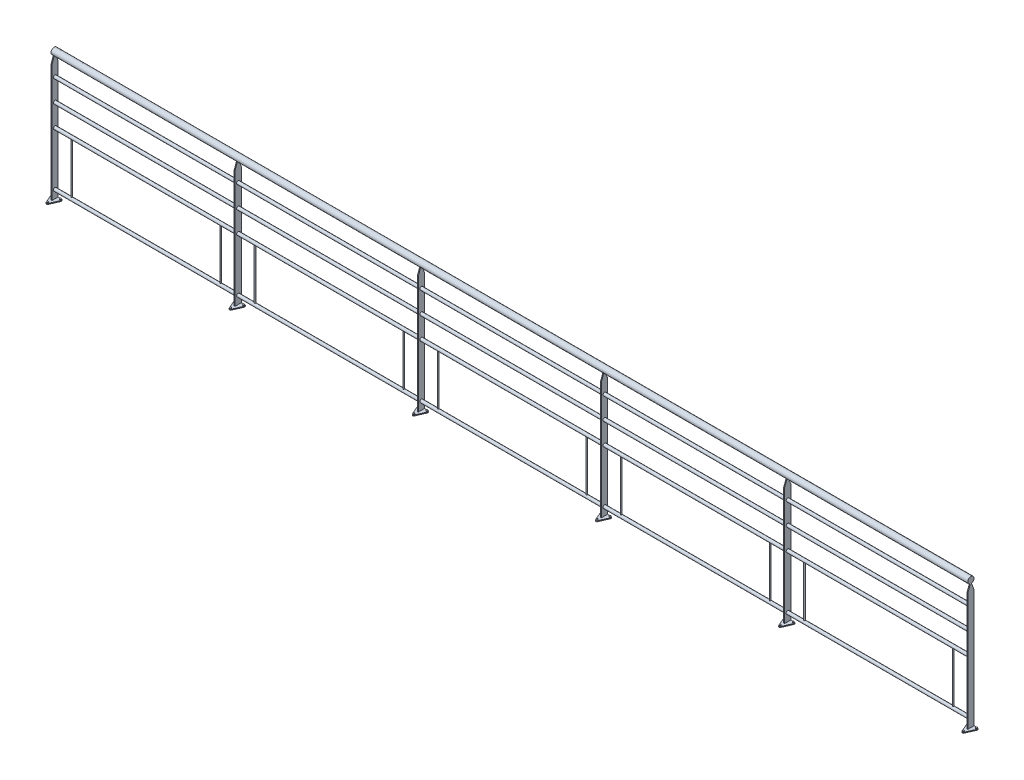
from build123d import *

# Parameters (mm, degrees)
BOSS_EXTRU_1_DEPTH                  = 7285
ESQUISSE3_W                         = 1448.6
ESQUISSE3_H                         = 990.505102572
ENL_V_MAT_EXTRU_1_DEPTH             = 7304.902739623
ESQUISSE4_R                         = 25
ESQUISSE4_R_2                       = 12.5
BOSS_EXTRU_2_DEPTH                  = 7285
BOSS_EXTRU_3_REACH                  = 7309.484
BOSS_EXTRU_3_END_RADIUS             = 12.5
ESQUISSE5_R                         = 4.5
BOSS_EXTRU_3_DIRECTION_2_REACH      = 7309.484
BOSS_EXTRU_3_DIRECTION_2_END_RADIUS = 12.5
BOSS_EXTRU_4_DEPTH                  = 7
ESQUISSE7_R                         = 5.5
BOSS_EXTRU_5_DEPTH                  = 10
CONG_1_R                            = 5.5


with BuildPart() as part:
    # Esquisse2 → Boss.-Extru.1 (new body)
    with BuildSketch(Plane(origin=(0, 0, 0), x_dir=(0, 0, -1), z_dir=(1, 0, 0))):
        with BuildLine():
            Line((-25, 467.752551286), (-25, -467.752551286))
            Line((-25, -467.752551286), (25, -467.752551286))
            Line((25, -467.752551286), (25, 467.752551286))
            Line((25, 467.752551286), (5, 522.752551286))
            ThreePointArc((5, 522.752551286), (0, 522.247448714), (-5, 522.752551286))
            Line((-5, 522.752551286), (-25, 467.752551286))
        make_face()
    extrude(amount=-BOSS_EXTRU_1_DEPTH)

    # Esquisse3 → Enlèv. mat.-Extru.1 (cut, through all)
    with BuildSketch(Plane.XY.offset(25)):
        with Locations((-6553.7, 27.5)):
            Rectangle(ESQUISSE3_W, ESQUISSE3_H)
        with Locations((-731.3, 27.5)):
            Rectangle(ESQUISSE3_W, ESQUISSE3_H)
        with Locations((-2186.9, 27.5)):
            Rectangle(ESQUISSE3_W, ESQUISSE3_H)
        with Locations((-3642.5, 27.5)):
            Rectangle(ESQUISSE3_W, ESQUISSE3_H)
        with Locations((-5098.1, 27.5)):
            Rectangle(ESQUISSE3_W, ESQUISSE3_H)
    extrude(amount=-ENL_V_MAT_EXTRU_1_DEPTH, mode=Mode.SUBTRACT)


with BuildPart() as enl_v_mat_extru_1_piece_1:
    # of the separate pieces the step leaves, piece 1, a body of its own (enl_v_mat_extru_1_pieces)
    add(part.part.solids().sort_by_distance((-4366.8, 522.752551286, 5))[0])



with BuildPart() as enl_v_mat_extru_1_piece_2:
    # of the separate pieces the step leaves, piece 2, a body of its own (enl_v_mat_extru_1_pieces)
    add(part.part.solids().sort_by_distance((-2911.2, 522.752551286, 5))[0])


with BuildPart() as enl_v_mat_extru_1_piece_3:
    # of the separate pieces the step leaves, piece 3, a body of its own (enl_v_mat_extru_1_pieces)
    add(part.part.solids().sort_by_distance((-5822.4, 522.752551286, 5))[0])


with BuildPart() as enl_v_mat_extru_1_piece_4:
    # of the separate pieces the step leaves, piece 4, a body of its own (enl_v_mat_extru_1_pieces)
    add(part.part.solids().sort_by_distance((-1455.6, 522.752551286, 5))[0])


with BuildPart() as enl_v_mat_extru_1_piece_5:
    # of the separate pieces the step leaves, piece 5, a body of its own (enl_v_mat_extru_1_pieces)
    add(part.part.solids().sort_by_distance((0, 522.752551286, 5))[0])


with BuildPart() as enl_v_mat_extru_1_piece_6:
    # of the separate pieces the step leaves, piece 6, a body of its own (enl_v_mat_extru_1_pieces)
    add(part.part.solids().sort_by_distance((-7278, 467.752551286, 25))[0])


with BuildPart() as enl_v_mat_extru_1_piece_1_1:
    add(enl_v_mat_extru_1_piece_1.part)

    add(enl_v_mat_extru_1_piece_2.part)  # Boss.-Extru.2 merges Enlèv. mat.-Extru.1 piece 2

    add(enl_v_mat_extru_1_piece_3.part)  # Boss.-Extru.2 merges Enlèv. mat.-Extru.1 piece 3

    add(enl_v_mat_extru_1_piece_4.part)  # Boss.-Extru.2 merges Enlèv. mat.-Extru.1 piece 4

    add(enl_v_mat_extru_1_piece_5.part)  # Boss.-Extru.2 merges Enlèv. mat.-Extru.1 piece 5

    add(enl_v_mat_extru_1_piece_6.part)  # Boss.-Extru.2 merges Enlèv. mat.-Extru.1 piece 6
    # Esquisse4 → Boss.-Extru.2 (add, through all)
    with BuildSketch(Plane(origin=(0, 0, 0), x_dir=(0, 0, -1), z_dir=(1, 0, 0))):
        with Locations(Location((0, 547.247448714, 0), (0, 0, 281.536959033))):
            Circle(ESQUISSE4_R)
        with Locations((0, -402.752551286)):
            Circle(ESQUISSE4_R_2)
        with Locations((0, 22.247448714)):
            Circle(ESQUISSE4_R_2)
        with Locations((0, 197.247448714)):
            Circle(ESQUISSE4_R_2)
        with Locations((0, 372.247448714)):
            Circle(ESQUISSE4_R_2)
    extrude(amount=-BOSS_EXTRU_2_DEPTH)

    # Boss.-Extru.3: up to this cylinder (the profile starts outside it)
    boss_extru_3_end = Plane(origin=(-3642.5, -402.752551286, 0), z_dir=(1, 0, 0)) * Cylinder(BOSS_EXTRU_3_END_RADIUS, 21649.368, mode=Mode.PRIVATE)
    # Esquisse5 → Boss.-Extru.3 (add, up to the surface)
    with BuildSketch(Plane(origin=(0, 0, 0), x_dir=(1, 0, 0), z_dir=(0, 1, 0)), mode=Mode.PRIVATE) as boss_extru_3_sk1:
        with Locations(Location((-7144.7, 0, 0), (0, 0, 90))):
            Circle(ESQUISSE5_R)
    boss_extru_3_tool1 = extrude(boss_extru_3_sk1.sketch, amount=-BOSS_EXTRU_3_REACH, mode=Mode.PRIVATE) - boss_extru_3_end
    add(boss_extru_3_tool1.solids().sort_by_distance((-7144.7, 0, 0))[0])
    # Esquisse5 → Boss.-Extru.3 (add, up to the surface)
    with BuildSketch(Plane(origin=(0, 0, 0), x_dir=(1, 0, 0), z_dir=(0, 1, 0)), mode=Mode.PRIVATE) as boss_extru_3_sk2:
        with Locations(Location((-5962.7, 0, 0), (0, 0, 90))):
            Circle(ESQUISSE5_R)
    boss_extru_3_tool2 = extrude(boss_extru_3_sk2.sketch, amount=-BOSS_EXTRU_3_REACH, mode=Mode.PRIVATE) - boss_extru_3_end
    add(boss_extru_3_tool2.solids().sort_by_distance((-5962.7, 0, 0))[0])
    # Esquisse5 → Boss.-Extru.3 (add, up to the surface)
    with BuildSketch(Plane(origin=(0, 0, 0), x_dir=(1, 0, 0), z_dir=(0, 1, 0)), mode=Mode.PRIVATE) as boss_extru_3_sk3:
        with Locations(Location((-5689.1, 0, 0), (0, 0, 90))):
            Circle(ESQUISSE5_R)
    boss_extru_3_tool3 = extrude(boss_extru_3_sk3.sketch, amount=-BOSS_EXTRU_3_REACH, mode=Mode.PRIVATE) - boss_extru_3_end
    add(boss_extru_3_tool3.solids().sort_by_distance((-5689.1, 0, 0))[0])
    # Esquisse5 → Boss.-Extru.3 (add, up to the surface)
    with BuildSketch(Plane(origin=(0, 0, 0), x_dir=(1, 0, 0), z_dir=(0, 1, 0)), mode=Mode.PRIVATE) as boss_extru_3_sk4:
        with Locations(Location((-4507.1, 0, 0), (0, 0, 90))):
            Circle(ESQUISSE5_R)
    boss_extru_3_tool4 = extrude(boss_extru_3_sk4.sketch, amount=-BOSS_EXTRU_3_REACH, mode=Mode.PRIVATE) - boss_extru_3_end
    add(boss_extru_3_tool4.solids().sort_by_distance((-4507.1, 0, 0))[0])
    # Esquisse5 → Boss.-Extru.3 (add, up to the surface)
    with BuildSketch(Plane(origin=(0, 0, 0), x_dir=(1, 0, 0), z_dir=(0, 1, 0)), mode=Mode.PRIVATE) as boss_extru_3_sk5:
        with Locations(Location((-4233.5, 0, 0), (0, 0, 90))):
            Circle(ESQUISSE5_R)
    boss_extru_3_tool5 = extrude(boss_extru_3_sk5.sketch, amount=-BOSS_EXTRU_3_REACH, mode=Mode.PRIVATE) - boss_extru_3_end
    add(boss_extru_3_tool5.solids().sort_by_distance((-4233.5, 0, 0))[0])
    # Esquisse5 → Boss.-Extru.3 (add, up to the surface)
    with BuildSketch(Plane(origin=(0, 0, 0), x_dir=(1, 0, 0), z_dir=(0, 1, 0)), mode=Mode.PRIVATE) as boss_extru_3_sk6:
        with Locations(Location((-3051.5, 0, 0), (0, 0, 90))):
            Circle(ESQUISSE5_R)
    boss_extru_3_tool6 = extrude(boss_extru_3_sk6.sketch, amount=-BOSS_EXTRU_3_REACH, mode=Mode.PRIVATE) - boss_extru_3_end
    add(boss_extru_3_tool6.solids().sort_by_distance((-3051.5, 0, 0))[0])
    # Esquisse5 → Boss.-Extru.3 (add, up to the surface)
    with BuildSketch(Plane(origin=(0, 0, 0), x_dir=(1, 0, 0), z_dir=(0, 1, 0)), mode=Mode.PRIVATE) as boss_extru_3_sk7:
        with Locations(Location((-2777.9, 0, 0), (0, 0, 90))):
            Circle(ESQUISSE5_R)
    boss_extru_3_tool7 = extrude(boss_extru_3_sk7.sketch, amount=-BOSS_EXTRU_3_REACH, mode=Mode.PRIVATE) - boss_extru_3_end
    add(boss_extru_3_tool7.solids().sort_by_distance((-2777.9, 0, 0))[0])
    # Esquisse5 → Boss.-Extru.3 (add, up to the surface)
    with BuildSketch(Plane(origin=(0, 0, 0), x_dir=(1, 0, 0), z_dir=(0, 1, 0)), mode=Mode.PRIVATE) as boss_extru_3_sk8:
        with Locations(Location((-1595.9, 0, 0), (0, 0, 90))):
            Circle(ESQUISSE5_R)
    boss_extru_3_tool8 = extrude(boss_extru_3_sk8.sketch, amount=-BOSS_EXTRU_3_REACH, mode=Mode.PRIVATE) - boss_extru_3_end
    add(boss_extru_3_tool8.solids().sort_by_distance((-1595.9, 0, 0))[0])
    # Esquisse5 → Boss.-Extru.3 (add, up to the surface)
    with BuildSketch(Plane(origin=(0, 0, 0), x_dir=(1, 0, 0), z_dir=(0, 1, 0)), mode=Mode.PRIVATE) as boss_extru_3_sk9:
        with Locations(Location((-1322.3, 0, 0), (0, 0, 90))):
            Circle(ESQUISSE5_R)
    boss_extru_3_tool9 = extrude(boss_extru_3_sk9.sketch, amount=-BOSS_EXTRU_3_REACH, mode=Mode.PRIVATE) - boss_extru_3_end
    add(boss_extru_3_tool9.solids().sort_by_distance((-1322.3, 0, 0))[0])
    # Esquisse5 → Boss.-Extru.3 (add, up to the surface)
    with BuildSketch(Plane(origin=(0, 0, 0), x_dir=(1, 0, 0), z_dir=(0, 1, 0)), mode=Mode.PRIVATE) as boss_extru_3_sk10:
        with Locations(Location((-140.3, 0, 0), (0, 0, 90))):
            Circle(ESQUISSE5_R)
    boss_extru_3_tool10 = extrude(boss_extru_3_sk10.sketch, amount=-BOSS_EXTRU_3_REACH, mode=Mode.PRIVATE) - boss_extru_3_end
    add(boss_extru_3_tool10.solids().sort_by_distance((-140.3, 0, 0))[0])

    # Boss.-Extru.3 direction 2: up to this cylinder (the profile starts outside it)
    boss_extru_3_direction_2_end = Plane(origin=(-3642.5, 22.247448714, 0), z_dir=(1, 0, 0)) * Cylinder(BOSS_EXTRU_3_DIRECTION_2_END_RADIUS, 21649.368, mode=Mode.PRIVATE)
    # Esquisse5 → Boss.-Extru.3 direction 2 (add, up to the surface)
    with BuildSketch(Plane(origin=(0, 0, 0), x_dir=(1, 0, 0), z_dir=(0, 1, 0)), mode=Mode.PRIVATE) as boss_extru_3_direction_2_sk1:
        with Locations(Location((-7144.7, 0, 0), (0, 0, 90))):
            Circle(ESQUISSE5_R)
    boss_extru_3_direction_2_tool1 = extrude(boss_extru_3_direction_2_sk1.sketch, amount=BOSS_EXTRU_3_DIRECTION_2_REACH, mode=Mode.PRIVATE) - boss_extru_3_direction_2_end
    add(boss_extru_3_direction_2_tool1.solids().sort_by_distance((-7144.7, 0, 0))[0])
    # Esquisse5 → Boss.-Extru.3 direction 2 (add, up to the surface)
    with BuildSketch(Plane(origin=(0, 0, 0), x_dir=(1, 0, 0), z_dir=(0, 1, 0)), mode=Mode.PRIVATE) as boss_extru_3_direction_2_sk2:
        with Locations(Location((-5962.7, 0, 0), (0, 0, 90))):
            Circle(ESQUISSE5_R)
    boss_extru_3_direction_2_tool2 = extrude(boss_extru_3_direction_2_sk2.sketch, amount=BOSS_EXTRU_3_DIRECTION_2_REACH, mode=Mode.PRIVATE) - boss_extru_3_direction_2_end
    add(boss_extru_3_direction_2_tool2.solids().sort_by_distance((-5962.7, 0, 0))[0])
    # Esquisse5 → Boss.-Extru.3 direction 2 (add, up to the surface)
    with BuildSketch(Plane(origin=(0, 0, 0), x_dir=(1, 0, 0), z_dir=(0, 1, 0)), mode=Mode.PRIVATE) as boss_extru_3_direction_2_sk3:
        with Locations(Location((-5689.1, 0, 0), (0, 0, 90))):
            Circle(ESQUISSE5_R)
    boss_extru_3_direction_2_tool3 = extrude(boss_extru_3_direction_2_sk3.sketch, amount=BOSS_EXTRU_3_DIRECTION_2_REACH, mode=Mode.PRIVATE) - boss_extru_3_direction_2_end
    add(boss_extru_3_direction_2_tool3.solids().sort_by_distance((-5689.1, 0, 0))[0])
    # Esquisse5 → Boss.-Extru.3 direction 2 (add, up to the surface)
    with BuildSketch(Plane(origin=(0, 0, 0), x_dir=(1, 0, 0), z_dir=(0, 1, 0)), mode=Mode.PRIVATE) as boss_extru_3_direction_2_sk4:
        with Locations(Location((-4507.1, 0, 0), (0, 0, 90))):
            Circle(ESQUISSE5_R)
    boss_extru_3_direction_2_tool4 = extrude(boss_extru_3_direction_2_sk4.sketch, amount=BOSS_EXTRU_3_DIRECTION_2_REACH, mode=Mode.PRIVATE) - boss_extru_3_direction_2_end
    add(boss_extru_3_direction_2_tool4.solids().sort_by_distance((-4507.1, 0, 0))[0])
    # Esquisse5 → Boss.-Extru.3 direction 2 (add, up to the surface)
    with BuildSketch(Plane(origin=(0, 0, 0), x_dir=(1, 0, 0), z_dir=(0, 1, 0)), mode=Mode.PRIVATE) as boss_extru_3_direction_2_sk5:
        with Locations(Location((-4233.5, 0, 0), (0, 0, 90))):
            Circle(ESQUISSE5_R)
    boss_extru_3_direction_2_tool5 = extrude(boss_extru_3_direction_2_sk5.sketch, amount=BOSS_EXTRU_3_DIRECTION_2_REACH, mode=Mode.PRIVATE) - boss_extru_3_direction_2_end
    add(boss_extru_3_direction_2_tool5.solids().sort_by_distance((-4233.5, 0, 0))[0])
    # Esquisse5 → Boss.-Extru.3 direction 2 (add, up to the surface)
    with BuildSketch(Plane(origin=(0, 0, 0), x_dir=(1, 0, 0), z_dir=(0, 1, 0)), mode=Mode.PRIVATE) as boss_extru_3_direction_2_sk6:
        with Locations(Location((-3051.5, 0, 0), (0, 0, 90))):
            Circle(ESQUISSE5_R)
    boss_extru_3_direction_2_tool6 = extrude(boss_extru_3_direction_2_sk6.sketch, amount=BOSS_EXTRU_3_DIRECTION_2_REACH, mode=Mode.PRIVATE) - boss_extru_3_direction_2_end
    add(boss_extru_3_direction_2_tool6.solids().sort_by_distance((-3051.5, 0, 0))[0])
    # Esquisse5 → Boss.-Extru.3 direction 2 (add, up to the surface)
    with BuildSketch(Plane(origin=(0, 0, 0), x_dir=(1, 0, 0), z_dir=(0, 1, 0)), mode=Mode.PRIVATE) as boss_extru_3_direction_2_sk7:
        with Locations(Location((-2777.9, 0, 0), (0, 0, 90))):
            Circle(ESQUISSE5_R)
    boss_extru_3_direction_2_tool7 = extrude(boss_extru_3_direction_2_sk7.sketch, amount=BOSS_EXTRU_3_DIRECTION_2_REACH, mode=Mode.PRIVATE) - boss_extru_3_direction_2_end
    add(boss_extru_3_direction_2_tool7.solids().sort_by_distance((-2777.9, 0, 0))[0])
    # Esquisse5 → Boss.-Extru.3 direction 2 (add, up to the surface)
    with BuildSketch(Plane(origin=(0, 0, 0), x_dir=(1, 0, 0), z_dir=(0, 1, 0)), mode=Mode.PRIVATE) as boss_extru_3_direction_2_sk8:
        with Locations(Location((-1595.9, 0, 0), (0, 0, 90))):
            Circle(ESQUISSE5_R)
    boss_extru_3_direction_2_tool8 = extrude(boss_extru_3_direction_2_sk8.sketch, amount=BOSS_EXTRU_3_DIRECTION_2_REACH, mode=Mode.PRIVATE) - boss_extru_3_direction_2_end
    add(boss_extru_3_direction_2_tool8.solids().sort_by_distance((-1595.9, 0, 0))[0])
    # Esquisse5 → Boss.-Extru.3 direction 2 (add, up to the surface)
    with BuildSketch(Plane(origin=(0, 0, 0), x_dir=(1, 0, 0), z_dir=(0, 1, 0)), mode=Mode.PRIVATE) as boss_extru_3_direction_2_sk9:
        with Locations(Location((-1322.3, 0, 0), (0, 0, 90))):
            Circle(ESQUISSE5_R)
    boss_extru_3_direction_2_tool9 = extrude(boss_extru_3_direction_2_sk9.sketch, amount=BOSS_EXTRU_3_DIRECTION_2_REACH, mode=Mode.PRIVATE) - boss_extru_3_direction_2_end
    add(boss_extru_3_direction_2_tool9.solids().sort_by_distance((-1322.3, 0, 0))[0])
    # Esquisse5 → Boss.-Extru.3 direction 2 (add, up to the surface)
    with BuildSketch(Plane(origin=(0, 0, 0), x_dir=(1, 0, 0), z_dir=(0, 1, 0)), mode=Mode.PRIVATE) as boss_extru_3_direction_2_sk10:
        with Locations(Location((-140.3, 0, 0), (0, 0, 90))):
            Circle(ESQUISSE5_R)
    boss_extru_3_direction_2_tool10 = extrude(boss_extru_3_direction_2_sk10.sketch, amount=BOSS_EXTRU_3_DIRECTION_2_REACH, mode=Mode.PRIVATE) - boss_extru_3_direction_2_end
    add(boss_extru_3_direction_2_tool10.solids().sort_by_distance((-140.3, 0, 0))[0])

    # Esquisse6 → Boss.-Extru.4 (add)
    with BuildSketch(Plane.XZ.offset(467.752551286)):
        with BuildLine():
            Line((-7312.538788963, -25), (-7250.461211037, -25))
            ThreePointArc((-7250.461211037, -25), (-7242.961211037, -20.943205671), (-7242.251801581, -12.445893246))
            Line((-7242.251801581, -12.445893246), (-7274, 60.095583292))
            ThreePointArc((-7274, 60.095583292), (-7281.5, 65), (-7289, 60.095583292))
            Line((-7289, 60.095583292), (-7320.748198419, -12.445893246))
            ThreePointArc((-7320.748198419, -12.445893246), (-7320.038788963, -20.943205671), (-7312.538788963, -25))
        make_face()
        with BuildLine():
            Line((-5856.938788963, -25), (-5794.861211037, -25))
            ThreePointArc((-5794.861211037, -25), (-5787.361211037, -20.943205671), (-5786.651801581, -12.445893246))
            Line((-5786.651801581, -12.445893246), (-5818.4, 60.095583292))
            ThreePointArc((-5818.4, 60.095583292), (-5825.9, 65), (-5833.4, 60.095583292))
            Line((-5833.4, 60.095583292), (-5865.148198419, -12.445893246))
            ThreePointArc((-5865.148198419, -12.445893246), (-5864.438788963, -20.943205671), (-5856.938788963, -25))
        make_face()
        with BuildLine():
            Line((-4401.338788963, -25), (-4339.261211037, -25))
            ThreePointArc((-4339.261211037, -25), (-4331.761211037, -20.943205671), (-4331.051801581, -12.445893246))
            Line((-4331.051801581, -12.445893246), (-4362.8, 60.095583292))
            ThreePointArc((-4362.8, 60.095583292), (-4370.3, 65), (-4377.8, 60.095583292))
            Line((-4377.8, 60.095583292), (-4409.548198419, -12.445893246))
            ThreePointArc((-4409.548198419, -12.445893246), (-4408.838788963, -20.943205671), (-4401.338788963, -25))
        make_face()
        with BuildLine():
            Line((-2945.738788963, -25), (-2883.661211037, -25))
            ThreePointArc((-2883.661211037, -25), (-2876.161211037, -20.943205671), (-2875.451801581, -12.445893246))
            Line((-2875.451801581, -12.445893246), (-2907.2, 60.095583292))
            ThreePointArc((-2907.2, 60.095583292), (-2914.7, 65), (-2922.2, 60.095583292))
            Line((-2922.2, 60.095583292), (-2953.948198419, -12.445893246))
            ThreePointArc((-2953.948198419, -12.445893246), (-2953.238788963, -20.943205671), (-2945.738788963, -25))
        make_face()
        with BuildLine():
            Line((-1490.138788963, -25), (-1428.061211037, -25))
            ThreePointArc((-1428.061211037, -25), (-1420.561211037, -20.943205671), (-1419.851801581, -12.445893246))
            Line((-1419.851801581, -12.445893246), (-1451.6, 60.095583292))
            ThreePointArc((-1451.6, 60.095583292), (-1459.1, 65), (-1466.6, 60.095583292))
            Line((-1466.6, 60.095583292), (-1498.348198419, -12.445893246))
            ThreePointArc((-1498.348198419, -12.445893246), (-1497.638788963, -20.943205671), (-1490.138788963, -25))
        make_face()
        with BuildLine():
            Line((-34.538788963, -25), (27.538788963, -25))
            ThreePointArc((27.538788963, -25), (35.038788963, -20.943205671), (35.748198419, -12.445893246))
            Line((35.748198419, -12.445893246), (4, 60.095583292))
            ThreePointArc((4, 60.095583292), (-3.5, 65), (-11, 60.095583292))
            Line((-11, 60.095583292), (-42.748198419, -12.445893246))
            ThreePointArc((-42.748198419, -12.445893246), (-42.038788963, -20.943205671), (-34.538788963, -25))
        make_face()
    extrude(amount=BOSS_EXTRU_4_DEPTH)

    # Esquisse7 → Boss.-Extru.5 (add)
    with BuildSketch(Plane(origin=(0, -467.752551286, 0), x_dir=(1, 0, 0), z_dir=(0, 1, 0))):
        with Locations(Location((-7312.538788963, 16.038788963, 0), (0, 0, 270))):
            Circle(ESQUISSE7_R)
        with Locations(Location((-7250.461211037, 16.038788963, 0), (0, 0, 270))):
            Circle(ESQUISSE7_R)
        with Locations(Location((-7281.5, -56.813164743, 0), (0, 0, 270))):
            Circle(ESQUISSE7_R)
        with Locations(Location((-5856.938788963, 16.038788963, 0), (0, 0, 270))):
            Circle(ESQUISSE7_R)
        with Locations(Location((-5794.861211037, 16.038788963, 0), (0, 0, 270))):
            Circle(ESQUISSE7_R)
        with Locations(Location((-5825.9, -56.813164743, 0), (0, 0, 270))):
            Circle(ESQUISSE7_R)
        with Locations(Location((-4401.338788963, 16.038788963, 0), (0, 0, 270))):
            Circle(ESQUISSE7_R)
        with Locations(Location((-4339.261211037, 16.038788963, 0), (0, 0, 270))):
            Circle(ESQUISSE7_R)
        with Locations(Location((-4370.3, -56.813164743, 0), (0, 0, 270))):
            Circle(ESQUISSE7_R)
        with Locations(Location((-2945.738788963, 16.038788963, 0), (0, 0, 270))):
            Circle(ESQUISSE7_R)
        with Locations(Location((-2883.661211037, 16.038788963, 0), (0, 0, 270))):
            Circle(ESQUISSE7_R)
        with Locations(Location((-2914.7, -56.813164743, 0), (0, 0, 270))):
            Circle(ESQUISSE7_R)
        with Locations(Location((-1490.138788963, 16.038788963, 0), (0, 0, 270))):
            Circle(ESQUISSE7_R)
        with Locations(Location((-1428.061211037, 16.038788963, 0), (0, 0, 270))):
            Circle(ESQUISSE7_R)
        with Locations(Location((-1459.1, -56.813164743, 0), (0, 0, 270))):
            Circle(ESQUISSE7_R)
        with Locations(Location((-34.538788963, 16.038788963, 0), (0, 0, 270))):
            Circle(ESQUISSE7_R)
        with Locations(Location((27.538788963, 16.038788963, 0), (0, 0, 270))):
            Circle(ESQUISSE7_R)
        with Locations(Location((-3.5, -56.813164743, 0), (0, 0, 270))):
            Circle(ESQUISSE7_R)
    extrude(amount=BOSS_EXTRU_5_DEPTH)

    # Congé1
    cong_1_edges = [enl_v_mat_extru_1_piece_1_1.edges().sort_by_distance(p)[0] for p in [
        (-7312.538788963, -457.752551286, -21.538788963),
        (-7250.461211037, -457.752551286, -21.538788963),
        (-7281.5, -457.752551286, 51.313164743),
        (-5856.938788963, -457.752551286, -21.538788963),
        (-5794.861211037, -457.752551286, -21.538788963),
        (-5825.9, -457.752551286, 51.313164743),
        (-4401.338788963, -457.752551286, -21.538788963),
        (-4339.261211037, -457.752551286, -21.538788963),
        (-4370.3, -457.752551286, 51.313164743),
        (-2945.738788963, -457.752551286, -21.538788963),
        (-2883.661211037, -457.752551286, -21.538788963),
        (-2914.7, -457.752551286, 51.313164743),
        (-1490.138788963, -457.752551286, -21.538788963),
        (-1428.061211037, -457.752551286, -21.538788963),
        (-1459.1, -457.752551286, 51.313164743),
        (-34.538788963, -457.752551286, -21.538788963),
        (27.538788963, -457.752551286, -21.538788963),
        (-3.5, -457.752551286, 51.313164743),
    ]]
    fillet(cong_1_edges, radius=CONG_1_R)


solid = enl_v_mat_extru_1_piece_1_1.part
